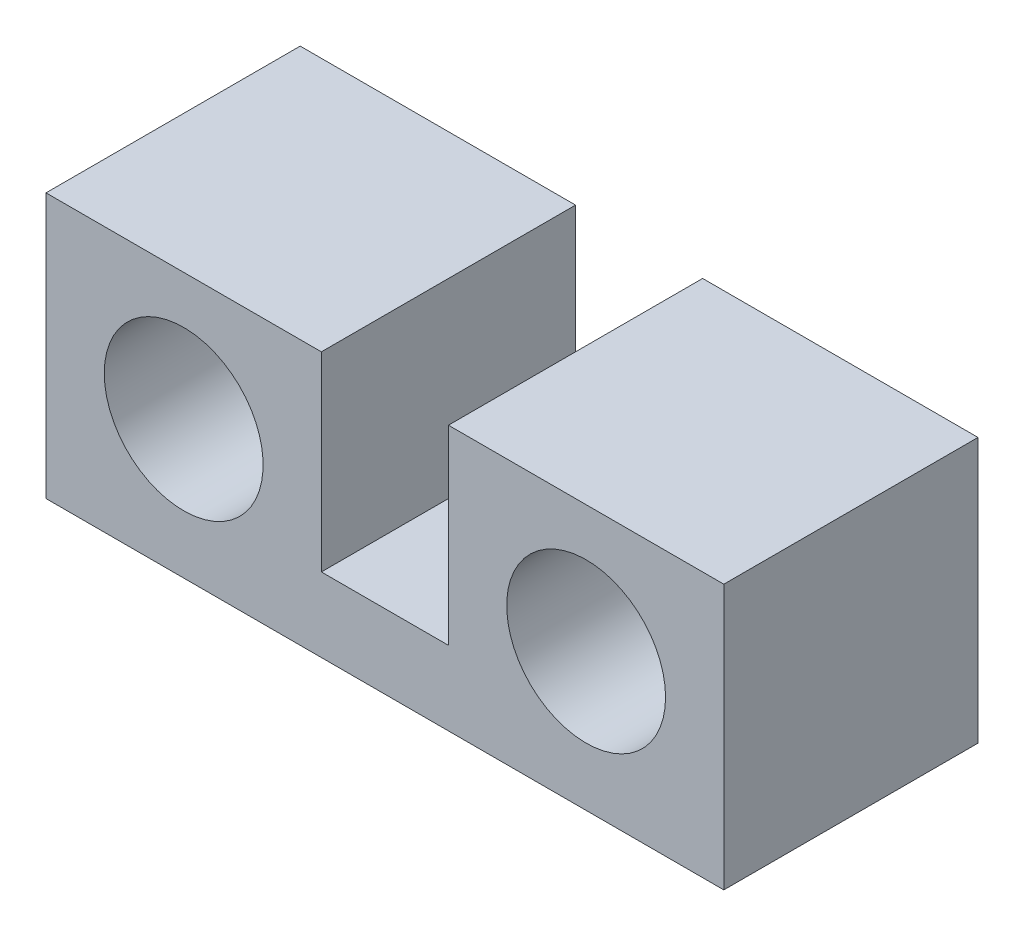
from build123d import *

# Parameters (mm, degrees)
SKETCH8_R           = 7.5
BOSS_EXTRUDE1_DEPTH = 12


with BuildPart() as part:
    # Sketch8 → Boss-Extrude1 (new, symmetric)
    with BuildSketch(Plane.XY):
        Polygon((0, 0), (32, 0), (32, 25), (6, 25), (6, 7), (0, 7), align=None)
        with Locations((19, 13)):
            Circle(SKETCH8_R, mode=Mode.SUBTRACT)
    boss_extrude1 = extrude(amount=BOSS_EXTRUDE1_DEPTH, both=True)

    # Mirror1: Boss-Extrude1 across plane
    add(boss_extrude1.mirror(Plane(origin=(0, 0, 0), x_dir=(0, 0, 1), z_dir=(1, 0, 0))))


solid = part.part
